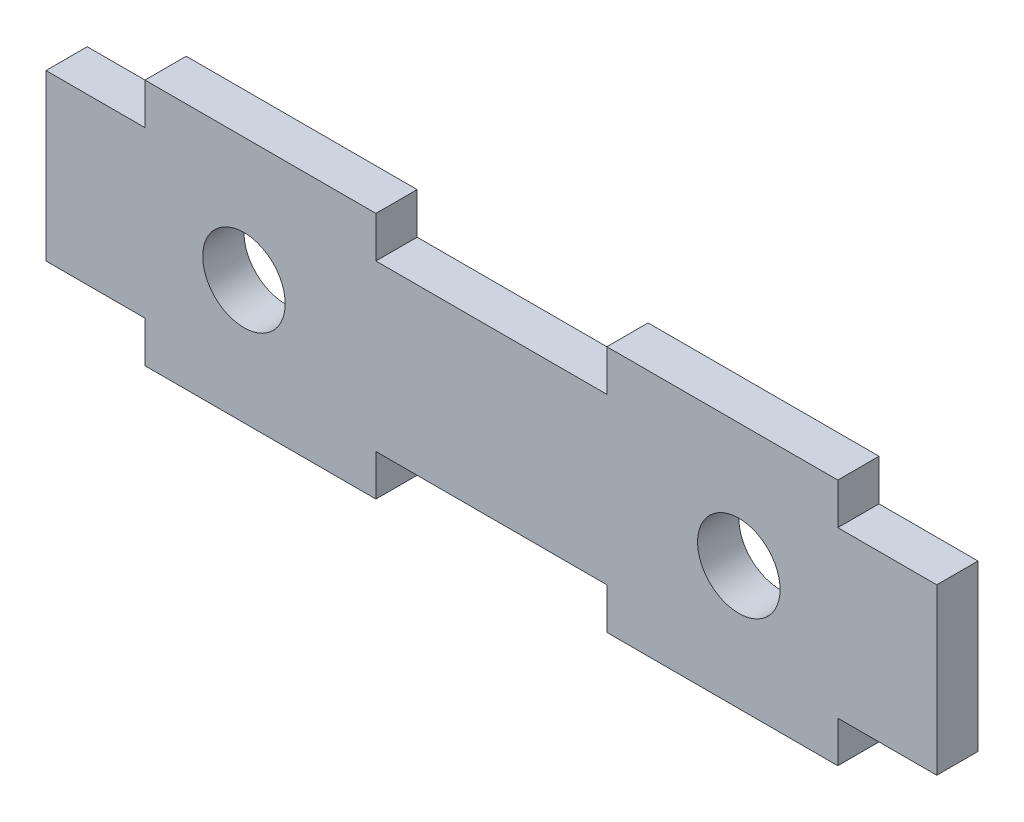
from build123d import *

# Parameters (mm, degrees)
SKETCH1_W               = 76.2
SKETCH1_H               = 19.05
BOSS_EXTRUDE1_DEPTH     = 3.175
SKETCH2_W               = 11.43
SKETCH2_H               = 3.175
CUT_EXTRUDE1_DEPTH      = 79.60930686
SKETCH3_W               = 17.78
SKETCH3_H               = 3.175
CUT_EXTRUDE2_DEPTH      = 79.60930686
MIRROR2_COPY_1_SKETCH_W = 11.43
MIRROR2_COPY_1_SKETCH_H = 3.175
MIRROR2_COPY_1_DEPTH    = 79.60930686
HOLE1_D                 = 6.35
SKETCH6_W               = 3.175
SKETCH6_H               = 12.7
CUT_EXTRUDE3_DEPTH      = 3.81
SKETCH7_W               = 3.175
SKETCH7_H               = 12.7
CUT_EXTRUDE4_DEPTH      = 3.81


with BuildPart() as part:
    # Sketch1 → Boss-Extrude1 (new body)
    with BuildSketch(Plane.XY):
        with Locations((38.1, -9.525)):
            Rectangle(SKETCH1_W, SKETCH1_H)
    extrude(amount=BOSS_EXTRUDE1_DEPTH)

    # Sketch2 → Cut-Extrude1 (cut, through all)
    with BuildSketch(Plane.XY.offset(3.175)):
        with Locations((5.715, -1.5875)):
            Rectangle(SKETCH2_W, SKETCH2_H)
    cut_extrude1 = extrude(amount=-CUT_EXTRUDE1_DEPTH, mode=Mode.SUBTRACT)

    # Mirror1: Cut-Extrude1 across plane
    add(cut_extrude1.mirror(Plane(origin=(38.1, 0, 0), x_dir=(0, 0, 1), z_dir=(1, 0, 0))), mode=Mode.SUBTRACT)

    # Sketch3 → Cut-Extrude2 (cut, through all)
    with BuildSketch(Plane.XY.offset(3.175)):
        with Locations((38.1, -1.5875)):
            Rectangle(SKETCH3_W, SKETCH3_H)
    cut_extrude2 = extrude(amount=-CUT_EXTRUDE2_DEPTH, mode=Mode.SUBTRACT)

    # Mirror2: Cut-Extrude1, Cut-Extrude2 across plane
    add(cut_extrude1.mirror(Plane.ZX.offset(-9.525)), mode=Mode.SUBTRACT)
    add(cut_extrude2.mirror(Plane.ZX.offset(-9.525)), mode=Mode.SUBTRACT)

    # Mirror2 copy 1 sketch → Mirror2 copy 1 (cut, through all)
    with BuildSketch(Plane(origin=(76.2, -19.05, 3.175), x_dir=(-1, 0, 0), z_dir=(0, 0, 1))):
        with Locations((5.715, -1.5875)):
            Rectangle(MIRROR2_COPY_1_SKETCH_W, MIRROR2_COPY_1_SKETCH_H)
    extrude(amount=-MIRROR2_COPY_1_DEPTH, mode=Mode.SUBTRACT)

    # Hole1 (through all)
    with Locations(Plane.XY.offset(3.175)):
        with Locations((19.05, -9.525), (57.15, -9.525)):
            Hole(HOLE1_D / 2)

    # Sketch6 → Cut-Extrude3 (cut)
    with BuildSketch(Plane.ZY):
        with Locations((1.5875, -9.525)):
            Rectangle(SKETCH6_W, SKETCH6_H)
    extrude(amount=-CUT_EXTRUDE3_DEPTH, mode=Mode.SUBTRACT)

    # Sketch7 → Cut-Extrude4 (cut)
    with BuildSketch(Plane(origin=(76.2, 0, 0), x_dir=(0, 0, -1), z_dir=(1, 0, 0))):
        with Locations((-1.5875, -9.525)):
            Rectangle(SKETCH7_W, SKETCH7_H)
    extrude(amount=-CUT_EXTRUDE4_DEPTH, mode=Mode.SUBTRACT)


solid = part.part
